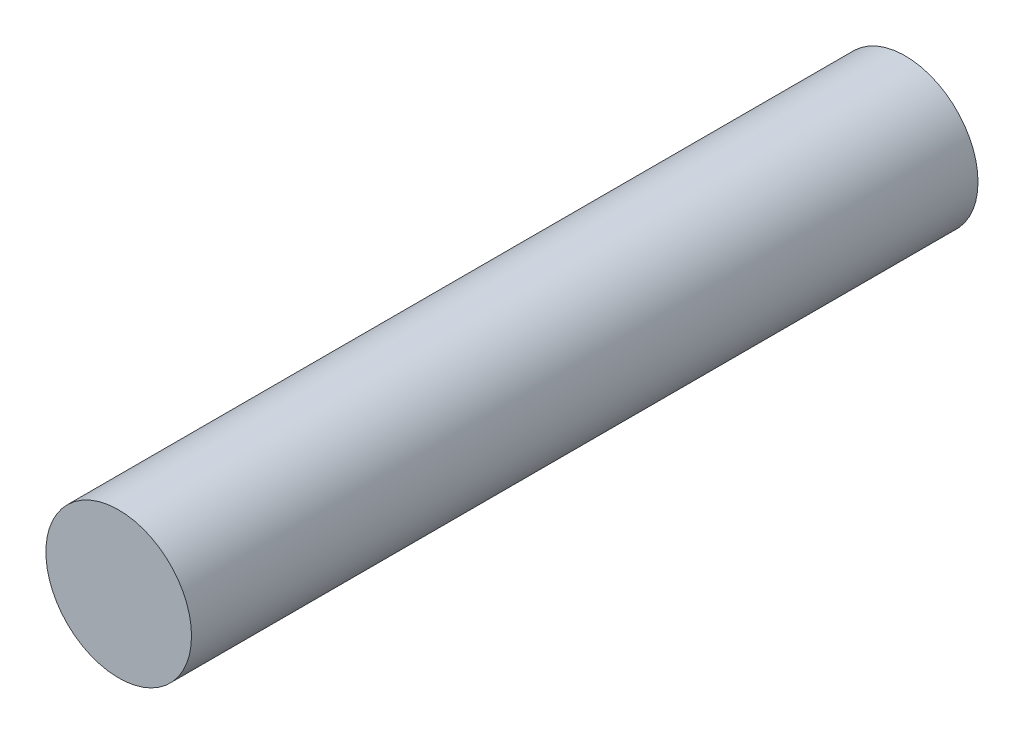
from build123d import *

# Parameters (mm, degrees)
SKETCH_1_R      = 2.5
EXTRUDE_1_DEPTH = 27


with BuildPart() as part:
    # 草图1 → 凸台-拉伸1 (new body)
    with BuildSketch(Plane.XY):
        Circle(SKETCH_1_R)
    extrude(amount=EXTRUDE_1_DEPTH)


solid = part.part
